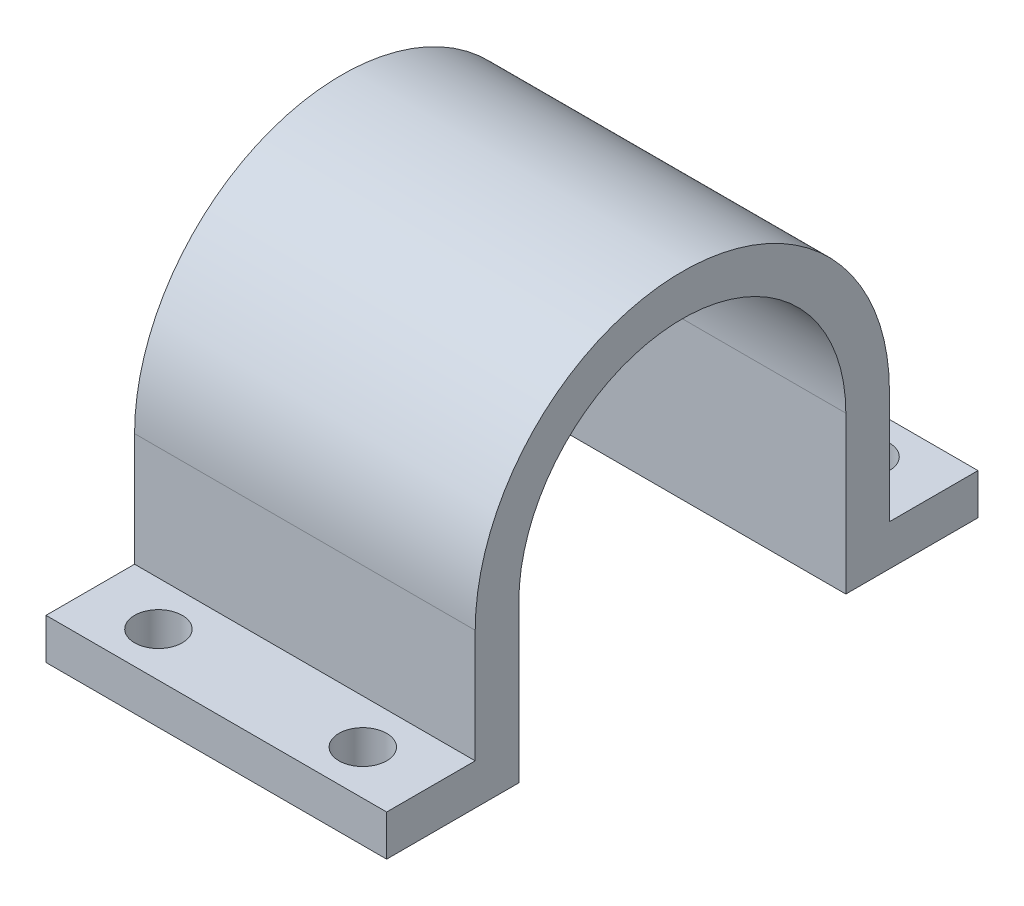
from build123d import *

# Parameters (mm, degrees)
BOSS_EXTRUDE1_DEPTH = 25
CUT_EXTRUDE1_DEPTH  = 43.404480895
SKETCH3_R           = 1.75
CUT_EXTRUDE2_DEPTH  = 41.59729055


with BuildPart() as part:
    # Sketch1 → Boss-Extrude1 (new body)
    with BuildSketch(Plane(origin=(0, 0, 0), x_dir=(0, 0, -1), z_dir=(1, 0, 0))):
        with BuildLine():
            Line((-21.7, 0), (-21.7, 3))
            Line((-21.7, 3), (-15.2, 3))
            Line((-15.2, 3), (-15.2, 11.3))
            ThreePointArc((-15.2, 11.3), (0, 26.5), (15.2, 11.3))
            Line((15.2, 11.3), (15.2, 3))
            Line((15.2, 3), (21.7, 3))
            Line((21.7, 3), (21.7, 0))
            Line((21.7, 0), (-21.7, 0))
        make_face()
    extrude(amount=BOSS_EXTRUDE1_DEPTH)

    # Sketch2 → Cut-Extrude1 (cut, through all)
    with BuildSketch(Plane(origin=(25, 0, 0), x_dir=(0, 0, -1), z_dir=(1, 0, 0))):
        with BuildLine():
            Line((-12, 11.5), (-12, 0))
            Line((-12, 0), (12, 0))
            Line((12, 0), (12, 11.5))
            ThreePointArc((12, 11.5), (0, 23.5), (-12, 11.5))
        make_face()
    extrude(amount=-CUT_EXTRUDE1_DEPTH, mode=Mode.SUBTRACT)

    # Sketch3 → Cut-Extrude2 (cut, through all)
    with BuildSketch(Plane(origin=(0, 3, 0), x_dir=(1, 0, 0), z_dir=(0, 1, 0))):
        with Locations(Location((5, -18.45, 0), (0, 0, 270))):
            Circle(SKETCH3_R)
        with Locations(Location((20, -18.45, 0), (0, 0, 270))):
            Circle(SKETCH3_R)
        with Locations(Location((5, 18.45, 0), (0, 0, 270))):
            Circle(SKETCH3_R)
        with Locations(Location((20, 18.45, 0), (0, 0, 270))):
            Circle(SKETCH3_R)
    extrude(amount=-CUT_EXTRUDE2_DEPTH, mode=Mode.SUBTRACT)


solid = part.part
